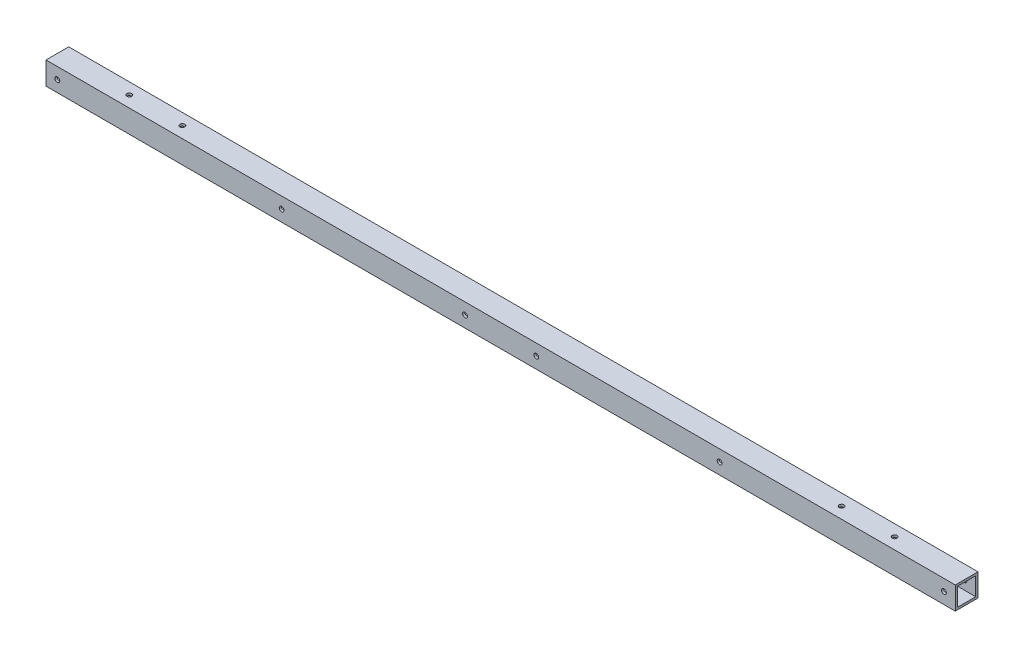
from build123d import *

# Parameters (mm, degrees)
SKETCH_2_W          = 600
SKETCH_2_H          = 15
SKETCH_2_R          = 1.6
EXTRUDE_1_DEPTH     = 15
SKETCH_3_W          = 12
SKETCH_3_H          = 12
CUT_EXTRUDE_1_DEPTH = 601.374882886
SKETCH_5_R          = 1.6
CUT_EXTRUDE_3_DEPTH = 601.374882886
SKETCH_6_R          = 1.6
CUT_EXTRUDE_4_DEPTH = 601.374882886


with BuildPart() as part:
    # ｽｹｯﾁ2 → ﾎﾞｽ - 押し出し1 (new body)
    with BuildSketch(Plane.XY):
        with Locations((300, -7.5)):
            Rectangle(SKETCH_2_W, SKETCH_2_H)
        with Locations((7.5, -7.5)):
            Circle(SKETCH_2_R, mode=Mode.SUBTRACT)
        with Locations((155.5, -7.5)):
            Circle(SKETCH_2_R, mode=Mode.SUBTRACT)
        with Locations((444.5, -7.5)):
            Circle(SKETCH_2_R, mode=Mode.SUBTRACT)
        with Locations((592.5, -7.5)):
            Circle(SKETCH_2_R, mode=Mode.SUBTRACT)
    extrude(amount=EXTRUDE_1_DEPTH)

    # ｽｹｯﾁ3 → ｶｯﾄ - 押し出し1 (cut, through all)
    with BuildSketch(Plane(origin=(600, 0, 0), x_dir=(0, 0, -1), z_dir=(1, 0, 0))):
        with Locations((-7.5, -7.5)):
            Rectangle(SKETCH_3_W, SKETCH_3_H)
    extrude(amount=-CUT_EXTRUDE_1_DEPTH, mode=Mode.SUBTRACT)

    # ｽｹｯﾁ5 → ｶｯﾄ - 押し出し3 (cut, through all)
    with BuildSketch(Plane.XZ.offset(15)):
        with Locations(Location((552.5, 7.5, 0), (0, 0, 270))):
            Circle(SKETCH_5_R)
        with Locations(Location((517.5, 7.5, 0), (0, 0, 270))):
            Circle(SKETCH_5_R)
        with Locations(Location((47.5, 7.5, 0), (0, 0, 270))):
            Circle(SKETCH_5_R)
        with Locations(Location((82.5, 7.5, 0), (0, 0, 270))):
            Circle(SKETCH_5_R)
    extrude(amount=-CUT_EXTRUDE_3_DEPTH, mode=Mode.SUBTRACT)

    # ｽｹｯﾁ6 → ｶｯﾄ - 押し出し4 (cut, through all)
    with BuildSketch(Plane.XY.offset(15)):
        with Locations((276.5, -7.5)):
            Circle(SKETCH_6_R)
        with Locations((323.5, -7.5)):
            Circle(SKETCH_6_R)
    extrude(amount=-CUT_EXTRUDE_4_DEPTH, mode=Mode.SUBTRACT)


solid = part.part
